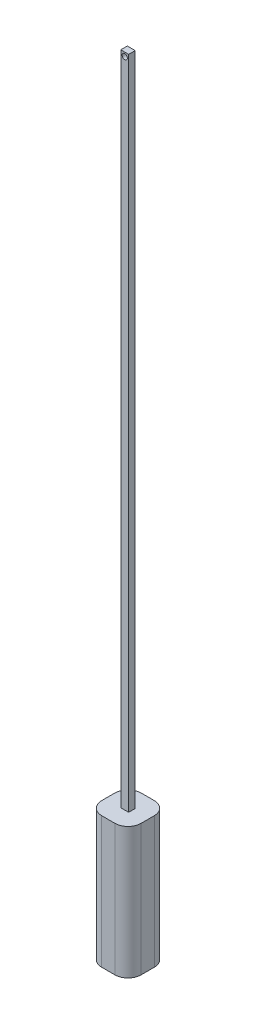
from build123d import *

# Parameters (mm, degrees)
SKETCH1_W           = 6
SKETCH1_H           = 500
SKETCH1_R           = 2
BOSS_EXTRUDE1_DEPTH = 5
SKETCH2_W           = 30
SKETCH2_H           = 30
BOSS_EXTRUDE2_DEPTH = 100
FILLET1_R           = 10


with BuildPart() as part:
    # Sketch1 → Boss-Extrude1 (new body)
    with BuildSketch(Plane.XY):
        with Locations((0, -247)):
            Rectangle(SKETCH1_W, SKETCH1_H)
        Circle(SKETCH1_R, mode=Mode.SUBTRACT)
    extrude(amount=BOSS_EXTRUDE1_DEPTH)

    # Sketch2 → Boss-Extrude2 (add)
    with BuildSketch(Plane.XZ.offset(497)):
        with Locations((0, 2.5)):
            Rectangle(SKETCH2_W, SKETCH2_H)
    extrude(amount=BOSS_EXTRUDE2_DEPTH)

    # Fillet1
    fillet1_edges = [part.edges().sort_by_distance(p)[0] for p in [
        (15, -547, -12.5),
        (15, -547, 17.5),
        (-15, -547, 17.5),
        (-15, -547, -12.5),
    ]]
    fillet(fillet1_edges, radius=FILLET1_R)


solid = part.part
